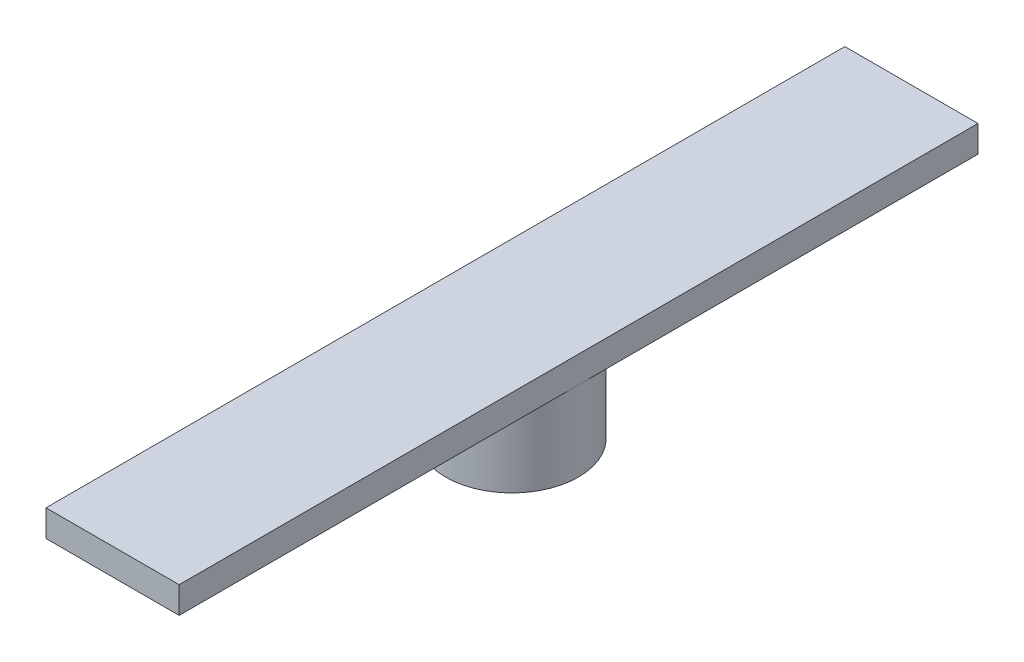
from build123d import *

# Parameters (mm, degrees)
ESQUISSE1_R        = 2.5
BOSS_EXTRU_1_DEPTH = 3
ESQUISSE2_W        = 5
ESQUISSE2_H        = 30
BOSS_EXTRU_2_DEPTH = 1


with BuildPart() as part:
    # Esquisse1 → Boss.-Extru.1 (new body)
    with BuildSketch(Plane(origin=(0, 0, 0), x_dir=(1, 0, 0), z_dir=(0, 1, 0))):
        with Locations(Location((0, 0, 0), (0, 0, 270))):
            Circle(ESQUISSE1_R)
    extrude(amount=BOSS_EXTRU_1_DEPTH)

    # Esquisse2 → Boss.-Extru.2 (add)
    with BuildSketch(Plane(origin=(0, 3, 0), x_dir=(1, 0, 0), z_dir=(0, 1, 0))):
        Rectangle(ESQUISSE2_W, ESQUISSE2_H)
    extrude(amount=BOSS_EXTRU_2_DEPTH)


solid = part.part
